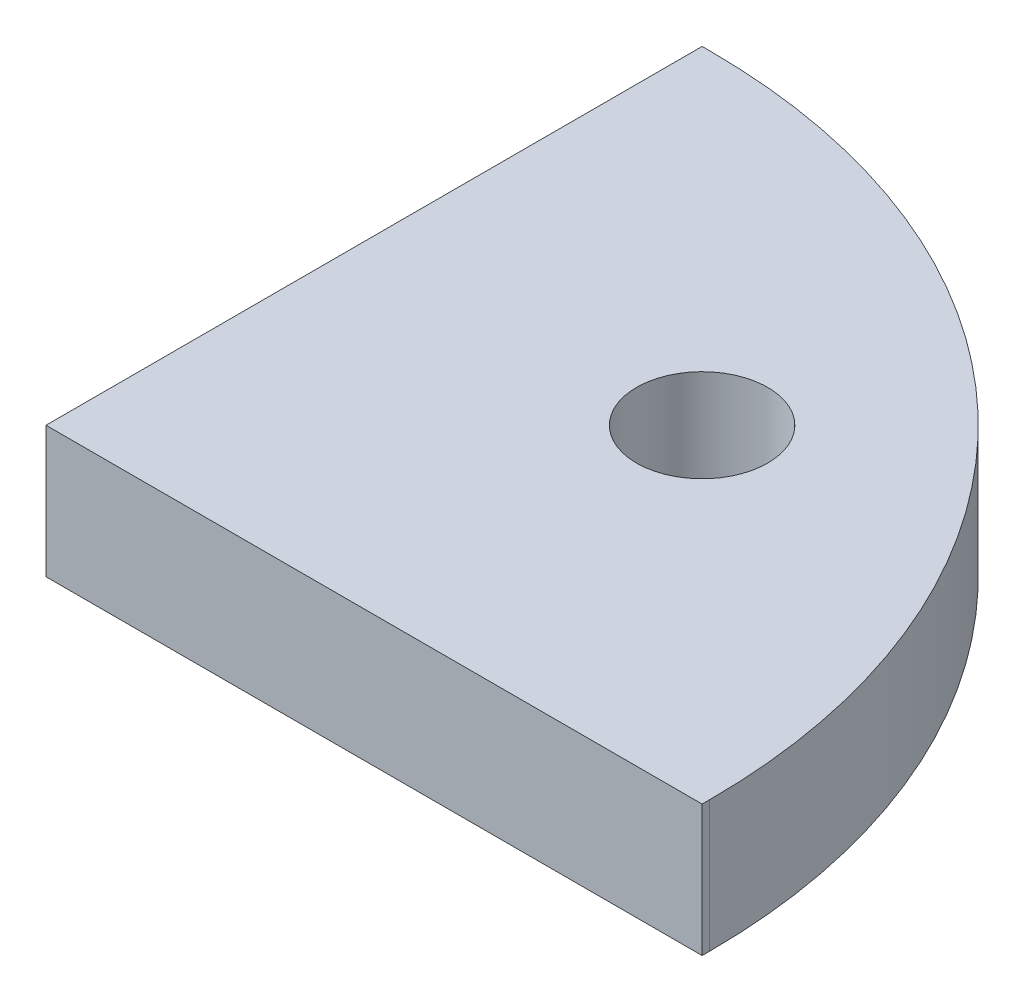
from build123d import *

# Parameters (mm, degrees)
SALIENTE_EXTRUIR1_DEPTH = 10
CROQUIS2_R              = 5
CORTAR_EXTRUIR1_DEPTH   = 10


with BuildPart() as part:
    # Croquis1 → Saliente-Extruir1 (new body)
    with BuildSketch(Plane(origin=(0, 0, 0), x_dir=(1, 0, 0), z_dir=(0, 1, 0))):
        with BuildLine():
            Line((-25, -25), (25, -25))
            Line((25, -25), (25, -24.43130904))
            ThreePointArc((25, -24.43130904), (10.521904785, 10.521904785), (-24.43130904, 25))
            Line((-24.43130904, 25), (-25, 25))
            Line((-25, 25), (-25, -25))
        make_face()
    extrude(amount=SALIENTE_EXTRUIR1_DEPTH)

    # Croquis2 → Cortar-Extruir1 (cut)
    with BuildSketch(Plane(origin=(0, 10, 0), x_dir=(1, 0, 0), z_dir=(0, 1, 0))):
        with Locations(Location((0, 0, 0), (0, 0, 270))):
            Circle(CROQUIS2_R)
    extrude(amount=-CORTAR_EXTRUIR1_DEPTH, mode=Mode.SUBTRACT)


solid = part.part
